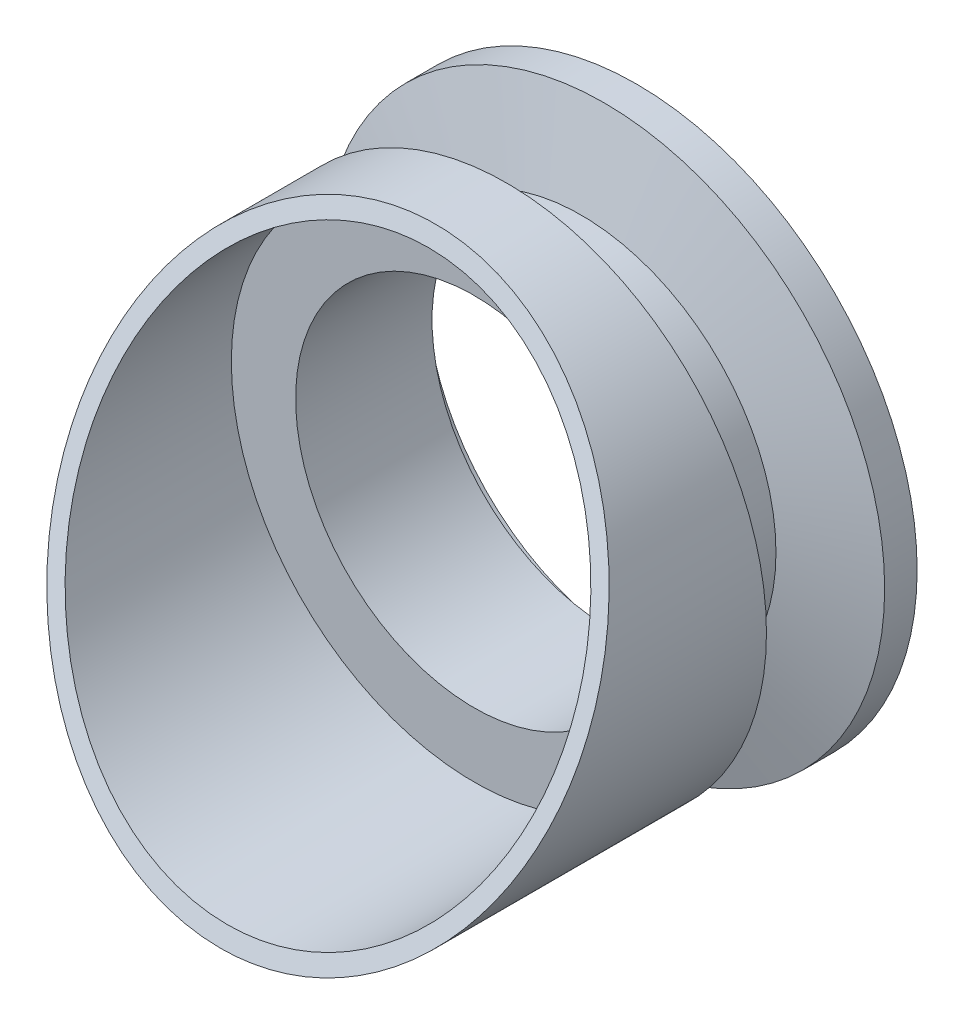
from build123d import *

# Parameters (mm, degrees)
CUT_EXTRUDE1_DEPTH      = 133.374626451
CUT_EXTRUDE1_DEPTH_BACK = 133.374626451


with BuildPart() as part:
    # Sketch4 → Revolve2 (revolve)
    with BuildSketch(Plane(origin=(0, 0, 0), x_dir=(0, 0, -1), z_dir=(1, 0, 0))):
        Polygon((87.3252, -33.3375), (100.6602, -33.3375), (100.6602, -30.226), (103.2002, -30.226), (103.2002, -23.368), (100.0252, -23.368), (97.779249869, -31.75), (90.5002, -31.75), (90.5002, -25.4), (58.7502, -25.4), (58.7502, -27.051), (87.3252, -27.051), align=None)
    revolve(axis=Axis((0, -50.8, -87.3252), (0, 0, -1)))

    # Sketch10 → Cut-Extrude1 (cut, two sides: drawn at the far end of the back side and taken through both)
    with BuildSketch(Plane(origin=(0, 0, 0), x_dir=(0, 0, -1), z_dir=(1, 0, 0)).offset(-CUT_EXTRUDE1_DEPTH_BACK)):
        Polygon((57.499707015, -88.281372884), (88.550292985, -13.318627116), (35.383859736, -13.318627116), (35.383859736, -88.281372884), align=None)
    extrude(amount=CUT_EXTRUDE1_DEPTH + CUT_EXTRUDE1_DEPTH_BACK, mode=Mode.SUBTRACT)


solid = part.part
